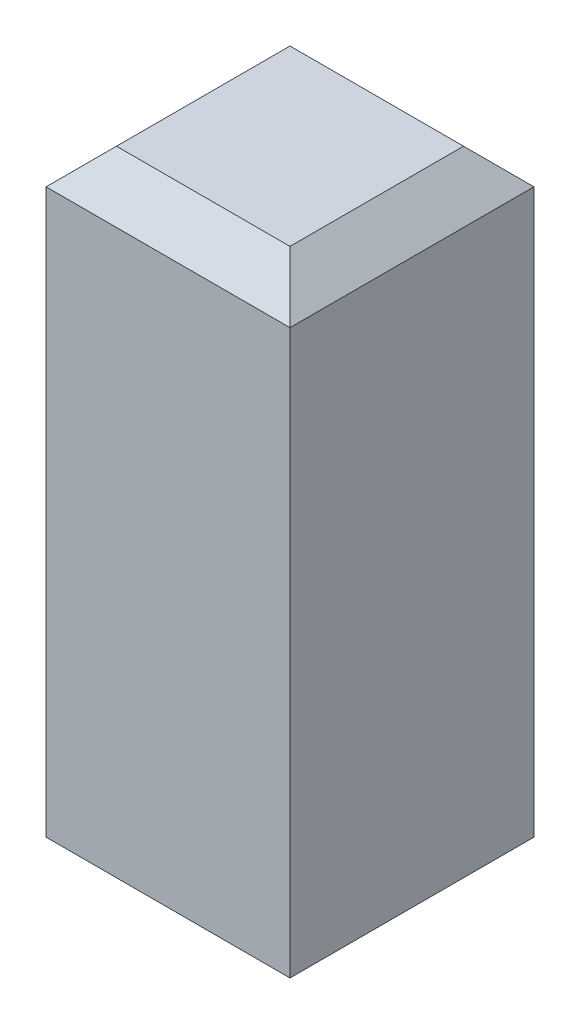
from build123d import *

# Parameters (mm, degrees)
SKETCH1_W           = 4.400325499
SKETCH1_H           = 4.400325499
BOSS_EXTRUDE1_DEPTH = 11.43
CHAMFER1_SIZE       = 0.635


with BuildPart() as part:
    # Sketch1 → Boss-Extrude1 (new body)
    with BuildSketch(Plane(origin=(0, 0, 0), x_dir=(1, 0, 0), z_dir=(0, 1, 0))):
        with Locations((2.20016275, 2.20016275)):
            Rectangle(SKETCH1_W, SKETCH1_H)
    extrude(amount=BOSS_EXTRUDE1_DEPTH)

    # Chamfer1
    chamfer1_edges = [part.edges().sort_by_distance(p)[0] for p in [
        (4.400325499, 11.43, -2.20016275),
        (2.20016275, 11.43, -4.400325499),
        (0, 11.43, -2.20016275),
        (2.20016275, 0, -4.400325499),
        (4.400325499, 0, -2.20016275),
        (2.20016275, 0, 0),
        (0, 0, -2.20016275),
        (2.20016275, 11.43, 0),
    ]]
    chamfer(chamfer1_edges, length=CHAMFER1_SIZE)


solid = part.part
